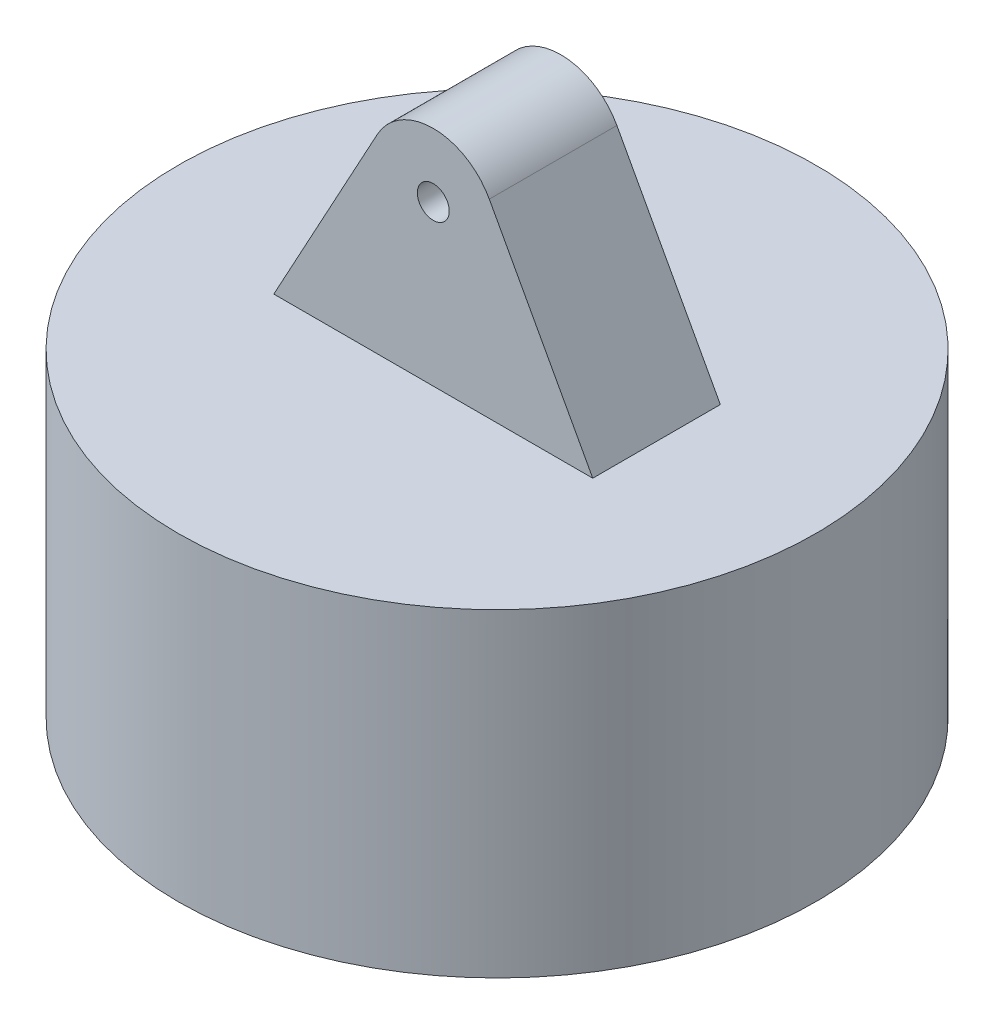
from build123d import *

# Parameters (mm, degrees)
SKETCH2_R           = 0.635
BOSS_EXTRUDE1_DEPTH = 2.54


with BuildPart() as part:
    # Sketch1 → Revolve1 (revolve)
    with BuildSketch(Plane.XY, mode=Mode.PRIVATE) as revolve1_sk:
        with BuildLine():
            Line((7.493, 0), (12.7, 0))
            Line((12.7, 0), (12.7, 12.7))
            Line((12.7, 12.7), (0, 12.7))
            Line((0, 12.7), (0, 7.493))
            ThreePointArc((0, 7.493), (5.298351111, 5.298351111), (7.493, 0))
        make_face()
    revolve(revolve1_sk.sketch.rotate(Axis((0, 12.7, 0), (0, -1, 0)), 180), axis=Axis((0, 12.7, 0), (0, -1, 0)))

    # Sketch2 → Boss-Extrude1 (add, symmetric)
    with BuildSketch(Plane.XY):
        with BuildLine():
            Line((-2.230711816, 20.264711816), (-6.35, 12.7))
            Line((-6.35, 12.7), (6.35, 12.7))
            Line((6.35, 12.7), (2.230711816, 20.264711816))
            ThreePointArc((2.230711816, 20.264711816), (0, 21.59), (-2.230711816, 20.264711816))
        make_face()
        with Locations((0, 19.05)):
            Circle(SKETCH2_R, mode=Mode.SUBTRACT)
    extrude(amount=BOSS_EXTRUDE1_DEPTH, both=True)


solid = part.part
